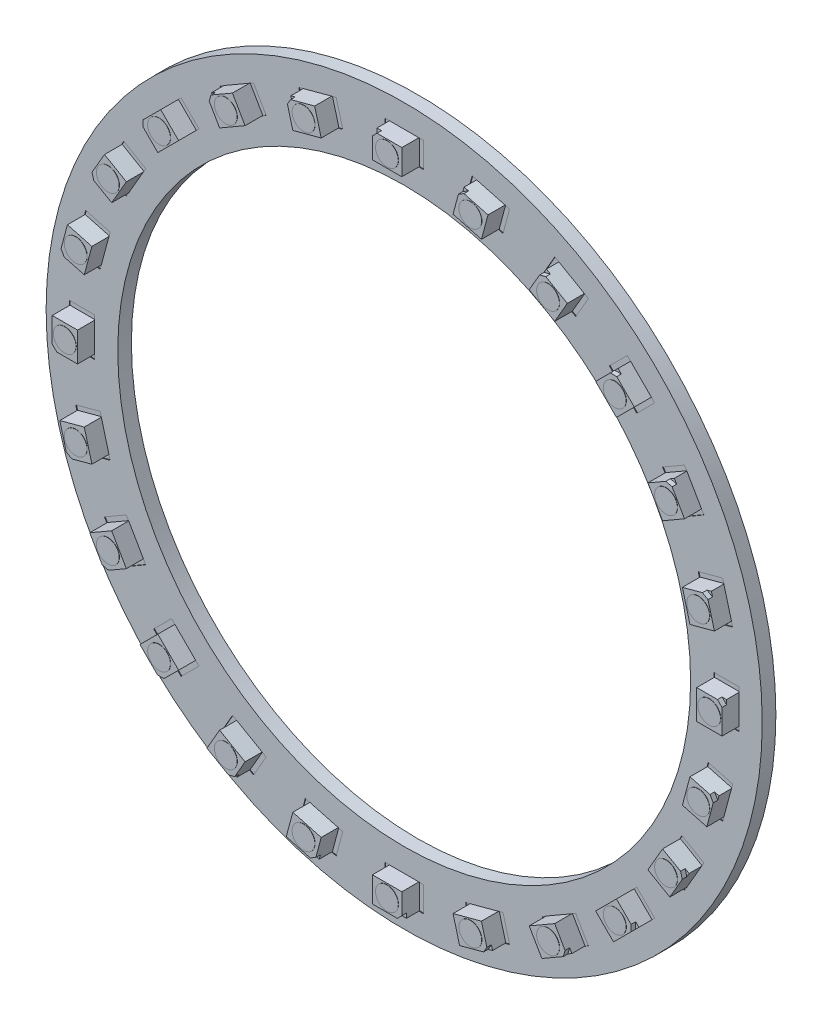
from build123d import *

# Parameters (mm, degrees)
SKETCH1_R           = 39.9034
SKETCH1_R_2         = 31.92018
BOSS_EXTRUDE1_DEPTH = 1.52
SKETCH2_W           = 3.2766
SKETCH2_H           = 2.8194
SKETCH2_W_2         = 2.8194
SKETCH2_H_2         = 3.2766
BOSS_EXTRUDE2_DEPTH = 1.90000001
SKETCH3_R           = 1.27
BOSS_EXTRUDE3_DEPTH = 0.0254
CIRPATTERN1_COUNT   = 24
CUT_EXTRUDE1_DEPTH  = 0.508
CIRPATTERN2_COUNT   = 24
SKETCH5_W           = 0.5207
SKETCH5_H           = 2.8194
CUT_EXTRUDE2_DEPTH  = 0.0762
CIRPATTERN3_COUNT   = 24


with BuildPart() as part:
    # Sketch1 → Boss-Extrude1 (new body)
    with BuildSketch(Plane.XY):
        Circle(SKETCH1_R)
        Circle(SKETCH1_R_2, mode=Mode.SUBTRACT)
    extrude(amount=BOSS_EXTRUDE1_DEPTH)

    # Sketch2 → Boss-Extrude2 (add)
    with BuildSketch(Plane.XY.offset(1.52)):
        with Locations((0, 35.91179)):
            Rectangle(SKETCH2_W, SKETCH2_H)
        Polygon((7.347321707, 33.750483034), (10.512274269, 32.90243655), (11.241988685, 35.625767825), (8.077036122, 36.473814308), align=None)
        Polygon((15.832235581, 30.698836424), (18.669854419, 29.060536424), (20.079554419, 31.502208447), (17.241935581, 33.140508447), align=None)
        Polygon((23.238208764, 25.555114844), (25.555114844, 23.238208764), (27.548731703, 25.231825623), (25.231825623, 27.548731703), align=None)
        Polygon((29.060536424, 18.669854419), (30.698836424, 15.832235581), (33.140508447, 17.241935581), (31.502208447, 20.079554419), align=None)
        Polygon((32.90243655, 10.512274269), (33.750483034, 7.347321707), (36.473814308, 8.077036122), (35.625767825, 11.241988685), align=None)
        with Locations((35.91179, 0)):
            Rectangle(SKETCH2_W_2, SKETCH2_H_2)
        Polygon((33.750483034, -7.347321707), (32.90243655, -10.512274269), (35.625767825, -11.241988685), (36.473814308, -8.077036122), align=None)
        Polygon((30.698836424, -15.832235581), (29.060536424, -18.669854419), (31.502208447, -20.079554419), (33.140508447, -17.241935581), align=None)
        Polygon((25.555114844, -23.238208764), (23.238208764, -25.555114844), (25.231825623, -27.548731703), (27.548731703, -25.231825623), align=None)
        Polygon((18.669854419, -29.060536424), (15.832235581, -30.698836424), (17.241935581, -33.140508447), (20.079554419, -31.502208447), align=None)
        Polygon((10.512274269, -32.90243655), (7.347321707, -33.750483034), (8.077036122, -36.473814308), (11.241988685, -35.625767825), align=None)
        with Locations((0, -35.91179)):
            Rectangle(SKETCH2_W, SKETCH2_H)
        Polygon((-7.347321707, -33.750483034), (-10.512274269, -32.90243655), (-11.241988685, -35.625767825), (-8.077036122, -36.473814308), align=None)
        Polygon((-15.832235581, -30.698836424), (-18.669854419, -29.060536424), (-20.079554419, -31.502208447), (-17.241935581, -33.140508447), align=None)
        Polygon((-23.238208764, -25.555114844), (-25.555114844, -23.238208764), (-27.548731703, -25.231825623), (-25.231825623, -27.548731703), align=None)
        Polygon((-29.060536424, -18.669854419), (-30.698836424, -15.832235581), (-33.140508447, -17.241935581), (-31.502208447, -20.079554419), align=None)
        Polygon((-32.90243655, -10.512274269), (-33.750483034, -7.347321707), (-36.473814308, -8.077036122), (-35.625767825, -11.241988685), align=None)
        with Locations((-35.91179, 0)):
            Rectangle(SKETCH2_W_2, SKETCH2_H_2)
        Polygon((-33.750483034, 7.347321707), (-32.90243655, 10.512274269), (-35.625767825, 11.241988685), (-36.473814308, 8.077036122), align=None)
        Polygon((-30.698836424, 15.832235581), (-29.060536424, 18.669854419), (-31.502208447, 20.079554419), (-33.140508447, 17.241935581), align=None)
        Polygon((-25.555114844, 23.238208764), (-23.238208764, 25.555114844), (-25.231825623, 27.548731703), (-27.548731703, 25.231825623), align=None)
        Polygon((-18.669854419, 29.060536424), (-15.832235581, 30.698836424), (-17.241935581, 33.140508447), (-20.079554419, 31.502208447), align=None)
        Polygon((-10.512274269, 32.90243655), (-7.347321707, 33.750483034), (-8.077036122, 36.473814308), (-11.241988685, 35.625767825), align=None)
    extrude(amount=BOSS_EXTRUDE2_DEPTH)

    # Sketch3 → Boss-Extrude3 (add)
    with BuildSketch(Plane.XY.offset(3.42000001)):
        with Locations(Location((9.294655196, 34.688125429, 0), (0, 0, 180))):
            Circle(SKETCH3_R)
    boss_extrude3 = extrude(amount=BOSS_EXTRUDE3_DEPTH)

    # CirPattern1: Boss-Extrude3 ×24 about axis
    cirpattern1_axis = Axis((0, 0, 0), (0, 0, 1))
    for i in range(1, CIRPATTERN1_COUNT):
        add(boss_extrude3.rotate(cirpattern1_axis, i * 360 / CIRPATTERN1_COUNT))

    # Sketch4 → Cut-Extrude1 (cut)
    with BuildSketch(Plane.XY.offset(3.42000001)):
        Polygon((-1.6383, 36.81349), (-1.1303, 37.32149), (-1.6383, 37.32149), align=None)
    cut_extrude1 = extrude(amount=-CUT_EXTRUDE1_DEPTH, mode=Mode.SUBTRACT)

    # CirPattern2: Cut-Extrude1 ×24 about axis
    cirpattern2_axis = Axis((0, 0, 0), (0, 0, 1))
    for i in range(1, CIRPATTERN2_COUNT):
        add(cut_extrude1.rotate(cirpattern2_axis, i * 360 / CIRPATTERN2_COUNT), mode=Mode.SUBTRACT)

    # Sketch5 → Cut-Extrude2 (cut)
    with BuildSketch(Plane.XY.offset(1.52)):
        with Locations((1.89865, 35.91179)):
            Rectangle(SKETCH5_W, SKETCH5_H)
        with Locations((-1.89865, 35.91179)):
            Rectangle(SKETCH5_W, SKETCH5_H)
    cut_extrude2 = extrude(amount=-CUT_EXTRUDE2_DEPTH, mode=Mode.SUBTRACT)

    # CirPattern3: Cut-Extrude2 ×24 about axis
    cirpattern3_axis = Axis((0, 0, 0), (0, 0, 1))
    for i in range(1, CIRPATTERN3_COUNT):
        add(cut_extrude2.rotate(cirpattern3_axis, i * 360 / CIRPATTERN3_COUNT), mode=Mode.SUBTRACT)


solid = part.part
